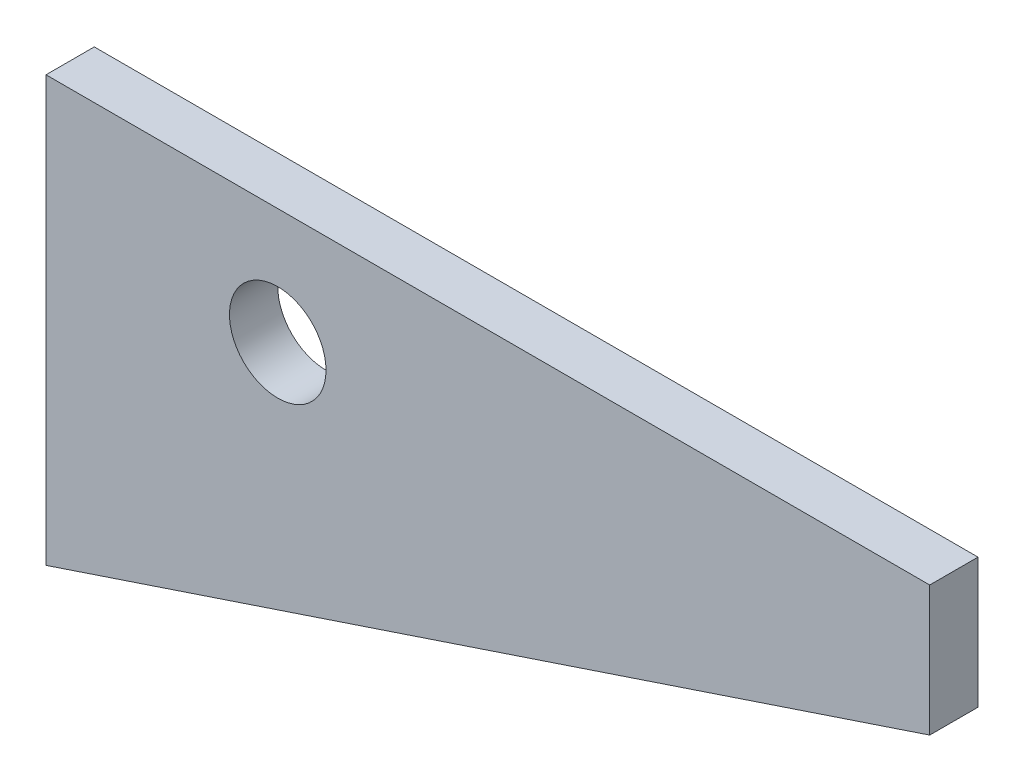
from build123d import *

# Parameters (mm, degrees)
SKETCH1_R           = 7.9375
BOSS_EXTRUDE1_DEPTH = 7.9375


with BuildPart() as part:
    # Sketch1 → Boss-Extrude1 (new body)
    with BuildSketch(Plane.XY):
        Polygon((0, 0), (145.288, 0), (145.288, -21.373249903), (0, -69.85), align=None)
        with Locations((38.1, -19.05)):
            Circle(SKETCH1_R, mode=Mode.SUBTRACT)
    extrude(amount=BOSS_EXTRUDE1_DEPTH)


solid = part.part
